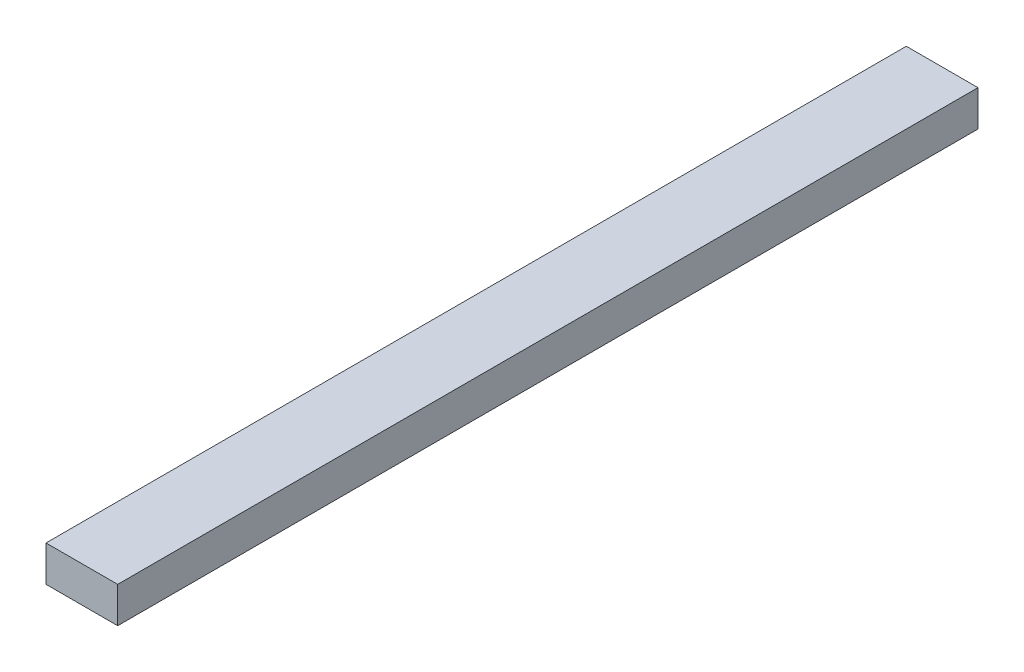
from build123d import *

# Parameters (mm, degrees)
SKETCH1_W           = 101.6
SKETCH1_H           = 50.8
BOSS_EXTRUDE1_DEPTH = 1219.2


with BuildPart() as part:
    # Sketch1 → Boss-Extrude1 (new body)
    with BuildSketch(Plane.XY):
        with Locations((50.8, 25.4)):
            Rectangle(SKETCH1_W, SKETCH1_H)
    extrude(amount=BOSS_EXTRUDE1_DEPTH)


solid = part.part
